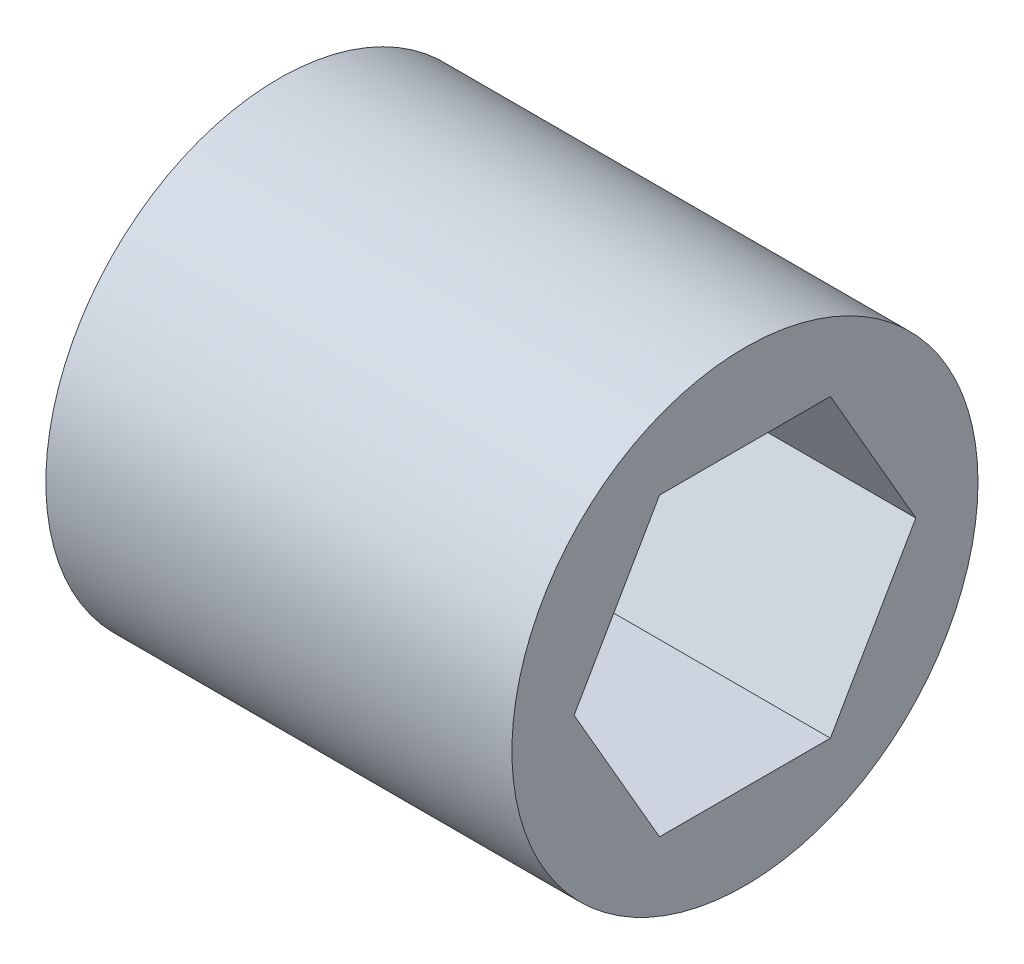
from build123d import *

# Parameters (mm, degrees)
CROQUIS1_R              = 10
SALIENTE_EXTRUIR1_DEPTH = 20


with BuildPart() as part:
    # Croquis1 → Saliente-Extruir1 (new body)
    with BuildSketch(Plane(origin=(0, 0, 0), x_dir=(0, 0, -1), z_dir=(1, 0, 0))):
        Circle(CROQUIS1_R)
        Polygon((7.332348419, 0), (3.666174209, 6.35), (-3.666174209, 6.35), (-7.332348419, 0), (-3.666174209, -6.35), (3.666174209, -6.35), align=None, mode=Mode.SUBTRACT)
    extrude(amount=SALIENTE_EXTRUIR1_DEPTH)


solid = part.part
